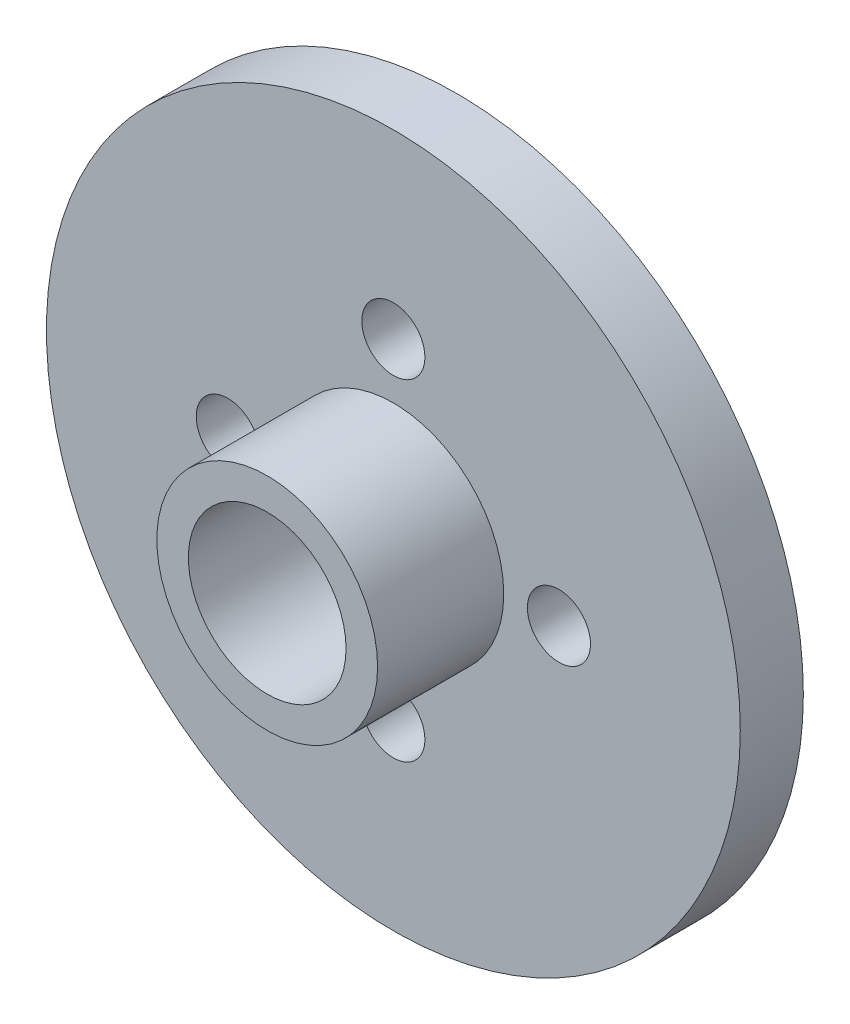
from build123d import *

# Parameters (mm, degrees)
SKETCH_1_R      = 11
SKETCH_1_R_2    = 2.5
SKETCH_1_R_3    = 1
EXTRUDE_1_DEPTH = 2
SKETCH_2_R      = 3.5
SKETCH_2_R_2    = 2.5
EXTRUDE_2_DEPTH = 4


with BuildPart() as part:
    # 草图1 → 凸台-拉伸1 (new body)
    with BuildSketch(Plane.XY):
        Circle(SKETCH_1_R)
        Circle(SKETCH_1_R_2, mode=Mode.SUBTRACT)
        with Locations((5.25, 0)):
            Circle(SKETCH_1_R_3, mode=Mode.SUBTRACT)
        with Locations((0, -5.25)):
            Circle(SKETCH_1_R_3, mode=Mode.SUBTRACT)
        with Locations((-5.25, 0)):
            Circle(SKETCH_1_R_3, mode=Mode.SUBTRACT)
        with Locations((0, 5.25)):
            Circle(SKETCH_1_R_3, mode=Mode.SUBTRACT)
    extrude(amount=EXTRUDE_1_DEPTH)

    # 草图2 → 凸台-拉伸2 (add)
    with BuildSketch(Plane.XY.offset(2)):
        Circle(SKETCH_2_R)
        Circle(SKETCH_2_R_2, mode=Mode.SUBTRACT)
    extrude(amount=EXTRUDE_2_DEPTH)


solid = part.part
